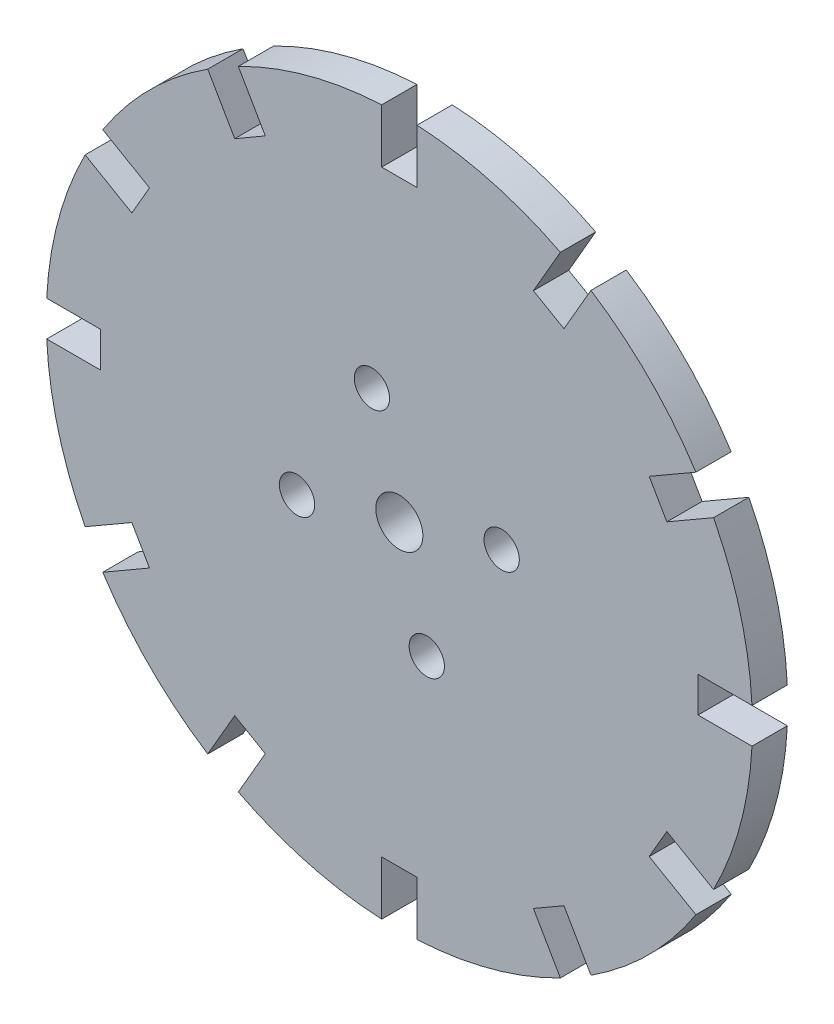
from build123d import *

# Parameters (mm, degrees)
MODEL_R                 = 1.5
MODEL_R_2               = 2
SALIENTE_EXTRUIR1_DEPTH = 3


with BuildPart() as part:
    # Model → Saliente-Extruir1 (new body)
    with BuildSketch(Plane.XY):
        with BuildLine():
            Line((63.474021053, 287.546128202), (61.181496903, 283.575359896))
            Line((61.181496903, 283.575359896), (58.583420692, 285.075359896))
            Line((58.583420692, 285.075359896), (60.875944842, 289.046128202))
            ThreePointArc((60.875944842, 289.046128202), (54.958316034, 291.325637152), (48.693744681, 292.310338897))
            Line((48.693744681, 292.310338897), (48.693744681, 287.725290597))
            Line((48.693744681, 287.725290597), (45.693744681, 287.725290597))
            Line((45.693744681, 287.725290597), (45.693744681, 292.310338897))
            ThreePointArc((45.693744681, 292.310338897), (39.429173328, 291.325637152), (33.51154452, 289.046128202))
            Line((33.51154452, 289.046128202), (35.80406867, 285.075359896))
            Line((35.80406867, 285.075359896), (33.205992459, 283.575359896))
            Line((33.205992459, 283.575359896), (30.913468309, 287.546128202))
            ThreePointArc((30.913468309, 287.546128202), (25.980541245, 283.561065799), (21.995478843, 278.628138736))
            Line((21.995478843, 278.628138736), (25.966247149, 276.335614586))
            Line((25.966247149, 276.335614586), (24.466247149, 273.737538374))
            Line((24.466247149, 273.737538374), (20.495478843, 276.030062525))
            ThreePointArc((20.495478843, 276.030062525), (18.215969892, 270.112433717), (17.231268148, 263.847862364))
            Line((17.231268148, 263.847862364), (21.816316448, 263.847862364))
            Line((21.816316448, 263.847862364), (21.816316448, 260.847862364))
            Line((21.816316448, 260.847862364), (17.231268148, 260.847862364))
            ThreePointArc((17.231268148, 260.847862364), (18.215969892, 254.583291011), (20.495478843, 248.665662203))
            Line((20.495478843, 248.665662203), (24.466247149, 250.958186353))
            Line((24.466247149, 250.958186353), (25.966247149, 248.360110142))
            Line((25.966247149, 248.360110142), (21.995478843, 246.067585992))
            ThreePointArc((21.995478843, 246.067585992), (25.980541245, 241.134658928), (30.913468309, 237.149596526))
            Line((30.913468309, 237.149596526), (33.205992459, 241.120364831))
            Line((33.205992459, 241.120364831), (35.80406867, 239.620364831))
            Line((35.80406867, 239.620364831), (33.51154452, 235.649596526))
            ThreePointArc((33.51154452, 235.649596526), (39.429173328, 233.370087575), (45.693744681, 232.385385831))
            Line((45.693744681, 232.385385831), (45.693744681, 236.970434131))
            Line((45.693744681, 236.970434131), (48.693744681, 236.970434131))
            Line((48.693744681, 236.970434131), (48.693744681, 232.385385831))
            ThreePointArc((48.693744681, 232.385385831), (54.958316034, 233.370087575), (60.875944842, 235.649596526))
            Line((60.875944842, 235.649596526), (58.583420692, 239.620364831))
            Line((58.583420692, 239.620364831), (61.181496903, 241.120364831))
            Line((61.181496903, 241.120364831), (63.474021053, 237.149596526))
            ThreePointArc((63.474021053, 237.149596526), (68.406948117, 241.134658928), (72.392010519, 246.067585992))
            Line((72.392010519, 246.067585992), (68.421242213, 248.360110142))
            Line((68.421242213, 248.360110142), (69.921242213, 250.958186353))
            Line((69.921242213, 250.958186353), (73.892010519, 248.665662203))
            ThreePointArc((73.892010519, 248.665662203), (76.17151947, 254.583291011), (77.156221214, 260.847862364))
            Line((77.156221214, 260.847862364), (72.571172914, 260.847862364))
            Line((72.571172914, 260.847862364), (72.571172914, 263.847862364))
            Line((72.571172914, 263.847862364), (77.156221214, 263.847862364))
            ThreePointArc((77.156221214, 263.847862364), (76.17151947, 270.112433717), (73.892010519, 276.030062525))
            Line((73.892010519, 276.030062525), (69.921242213, 273.737538374))
            Line((69.921242213, 273.737538374), (68.421242213, 276.335614586))
            Line((68.421242213, 276.335614586), (72.392010519, 278.628138736))
            ThreePointArc((72.392010519, 278.628138736), (68.406948117, 283.561065799), (63.474021053, 287.546128202))
        make_face()
        with Locations((38.500412244, 260.018490958)):
            Circle(MODEL_R, mode=Mode.SUBTRACT)
        with Locations((47.193744681, 262.347862364)):
            Circle(MODEL_R_2, mode=Mode.SUBTRACT)
        with Locations((49.523116087, 253.654529927)):
            Circle(MODEL_R, mode=Mode.SUBTRACT)
        with Locations((44.864373275, 271.0411948)):
            Circle(MODEL_R, mode=Mode.SUBTRACT)
        with Locations((55.887077118, 264.67723377)):
            Circle(MODEL_R, mode=Mode.SUBTRACT)
    extrude(amount=SALIENTE_EXTRUIR1_DEPTH)


solid = part.part
